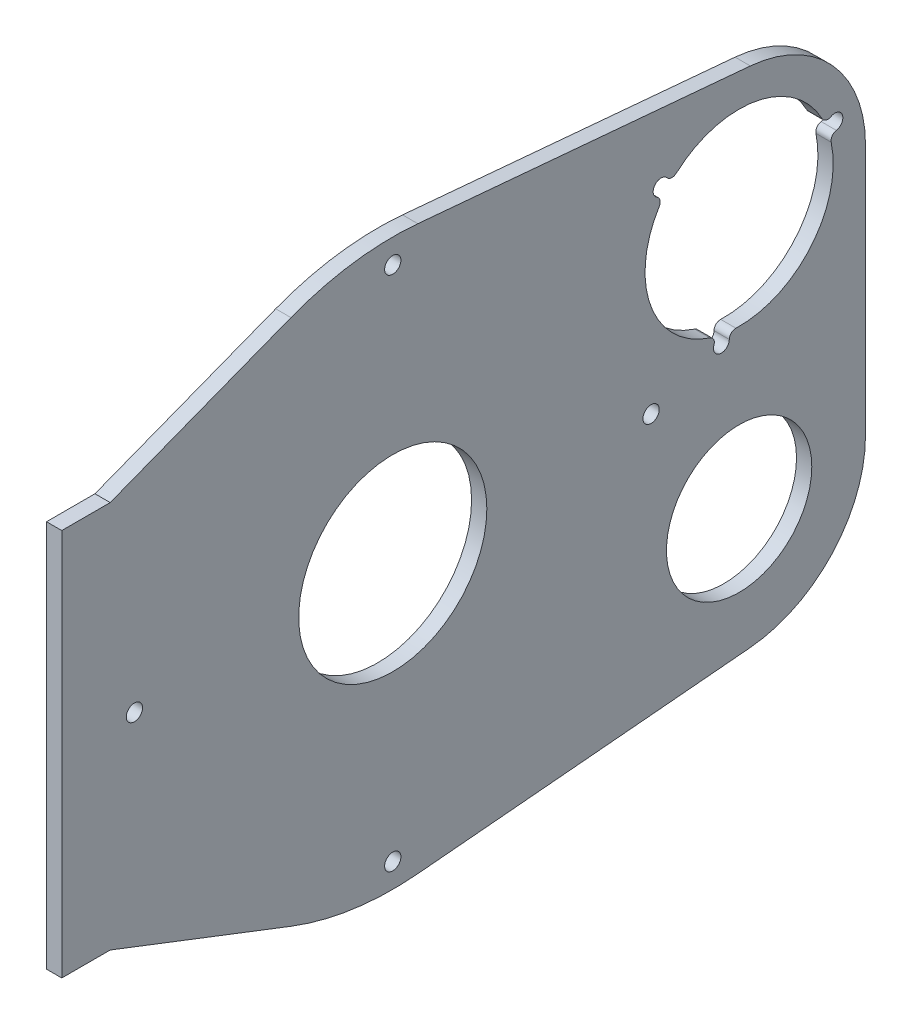
from build123d import *

# Parameters (mm, degrees)
SKETCH1_R           = 1.6
SKETCH1_R_2         = 18.5
SKETCH1_R_3         = 14.2875
SKETCH1_W           = 9.525
SKETCH1_H           = 76.2
BOSS_EXTRUDE1_DEPTH = 3
CUT_EXTRUDE1_DEPTH  = 109.338539954
CIRPATTERN1_COUNT   = 3


with BuildPart() as part:
    # Sketch1 → Boss-Extrude1 (new body)
    # profile 1 of 2: a face of its own
    with BuildSketch(Plane(origin=(0, 0, 0), x_dir=(0, 0, -1), z_dir=(1, 0, 0))):
        with BuildLine():
            ThreePointArc((4.931768052, -55.34319353), (-7.747067981, -55.019763212), (-20.022244586, -51.829539145))
            Line((-20.022244586, -51.829539145), (-55.5625, -38.1))
            Line((-55.5625, -38.1), (-55.5625, 38.1))
            Line((-55.5625, 38.1), (-20.022244586, 51.829539145))
            ThreePointArc((-20.022244586, 51.829539145), (-7.747067981, 55.019763212), (4.931768052, 55.34319353))
            Line((4.931768052, 55.34319353), (70.31294072, 49.516916477))
            ThreePointArc((70.31294072, 49.516916477), (86.442097474, 41.538651245), (92.957236583, 24.765))
            Line((92.957236583, 24.765), (92.957236583, -24.765))
            ThreePointArc((92.957236583, -24.765), (86.442097474, -41.538651245), (70.31294072, -49.516916477))
            Line((70.31294072, -49.516916477), (4.931768052, -55.34319353))
        make_face()
        with Locations((-50.8, 0)):
            Circle(SKETCH1_R, mode=Mode.SUBTRACT)
        with Locations((0, -50.8)):
            Circle(SKETCH1_R, mode=Mode.SUBTRACT)
        with Locations((50.8, 0)):
            Circle(SKETCH1_R, mode=Mode.SUBTRACT)
        with Locations((0, 50.8)):
            Circle(SKETCH1_R, mode=Mode.SUBTRACT)
        Circle(SKETCH1_R_2, mode=Mode.SUBTRACT)
        with Locations((68.107236583, -24.765)):
            Circle(SKETCH1_R_3, mode=Mode.SUBTRACT)
        with Locations((68.107236583, 24.765)):
            Circle(SKETCH1_R_2, mode=Mode.SUBTRACT)
    # profile 2 of 2: a face of its own
    with BuildSketch(Plane(origin=(0, 0, 0), x_dir=(0, 0, -1), z_dir=(1, 0, 0))):
        with Locations((-60.325, 0)):
            Rectangle(SKETCH1_W, SKETCH1_H)
    extrude(amount=BOSS_EXTRUDE1_DEPTH)

    # Sketch2 → Cut-Extrude1 (cut, symmetric)
    with BuildSketch(Plane.ZY):
        with BuildLine():
            ThreePointArc((-86.182075073, 32.962919695), (-88.406895893, 32.146316407), (-87.226207177, 30.09140941))
            ThreePointArc((-87.226207177, 30.09140941), (-86.398498104, 29.550435617), (-86.209643196, 28.579823038))
            ThreePointArc((-86.209643196, 28.579823038), (-85.493518863, 31.086960811), (-84.432027328, 33.46851694))
            ThreePointArc((-84.432027328, 33.46851694), (-85.200208842, 32.845899791), (-86.182075073, 32.962919695))
        make_face()
    cut_extrude1 = extrude(amount=CUT_EXTRUDE1_DEPTH, both=True, mode=Mode.SUBTRACT)

    # CirPattern1: Cut-Extrude1 ×3 about axis
    cirpattern1_axis = Axis((0, 24.765, -68.107236583), (1, 0, 0))
    for i in range(1, CIRPATTERN1_COUNT):
        add(cut_extrude1.rotate(cirpattern1_axis, i * 360 / CIRPATTERN1_COUNT), mode=Mode.SUBTRACT)


solid = part.part
